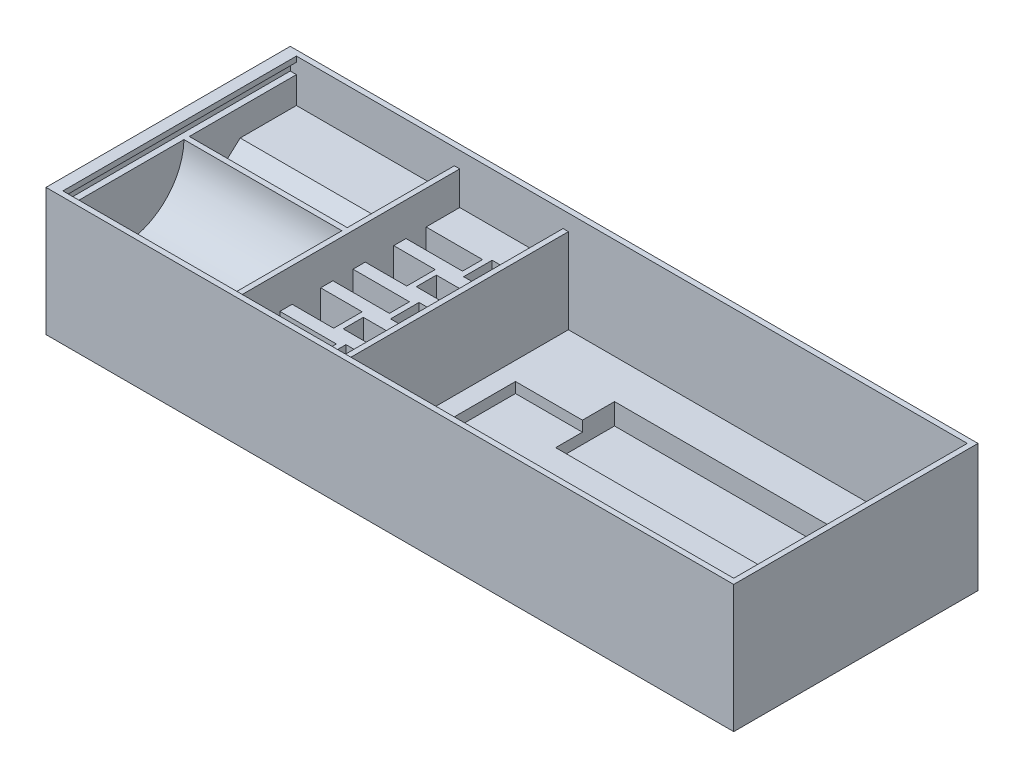
from build123d import *

# Parameters (mm, degrees)
BOSS_EXTRUDE1_DEPTH  = 2
BOSS_EXTRUDE2_DEPTH  = 87.25
BOSS_EXTRUDE4_DEPTH  = 2
BOSS_EXTRUDE5_DEPTH  = 59
SKETCH5_3_W          = 2
SKETCH5_3_H          = 10
BOSS_EXTRUDE6_DEPTH  = 59
BOSS_EXTRUDE7_DEPTH  = 59
BOSS_EXTRUDE8_DEPTH  = 6
SKETCH8_W            = 38.6
SKETCH8_H            = 87.25
CUT_EXTRUDE1_DEPTH   = 12.5
SKETCH9_W            = 15.5
SKETCH9_H            = 10.65
CUT_EXTRUDE2_DEPTH   = 13.6
SKETCH9_4_W          = 21.1
SKETCH9_4_H          = 7.5
CUT_EXTRUDE3_DEPTH   = 8.6
SKETCH10_W           = 135.3
SKETCH10_H           = 14.625
BOSS_EXTRUDE9_DEPTH  = 7.9
BOSS_EXTRUDE10_DEPTH = 4
SKETCH11_W           = 25
SKETCH11_H           = 7.9
BOSS_EXTRUDE14_DEPTH = 22
SKETCH12_W           = 25
SKETCH12_H           = 10
CUT_EXTRUDE4_DEPTH   = 3.9


with BuildPart() as part:
    # Sketch2 → Boss-Extrude1 (new body)
    with BuildSketch(Plane.XY):
        Polygon((-256.9, 0), (0, 0), (0, 41.64), (-254.9, 41.64), (-254.9, 45.64), (-252.6, 45.64), (-252.6, 47.64), (-256.9, 47.64), align=None)
    extrude(amount=-BOSS_EXTRUDE1_DEPTH)

    # Sketch2<3> → Boss-Extrude2 (add)
    with BuildSketch(Plane.XY):
        Polygon((-256.9, 0), (0, 0), (0, 41.64), (-2, 41.64), (-2, 9.9), (-8.85, 9.9), (-8.85, 2), (-144.15, 2), (-144.15, 9.9), (-151, 9.9), (-151, 41.64), (-153, 41.64), (-191.6, 41.64), (-193.6, 41.64), (-193.6, 2), (-252.6, 2), (-252.6, 41.64), (-254.9, 41.64), (-254.9, 45.64), (-252.6, 45.64), (-252.6, 47.64), (-256.9, 47.64), align=None)
    extrude(amount=BOSS_EXTRUDE2_DEPTH)

    # Sketch4 → Boss-Extrude4 (add)
    with BuildSketch(Plane.XY.offset(87.25)):
        Polygon((-256.9, 47.64), (-256.9, 0), (0, 0), (0, 41.64), (-254.9, 41.64), (-254.9, 45.64), (-252.6, 45.64), (-252.6, 47.64), align=None)
    extrude(amount=BOSS_EXTRUDE4_DEPTH)

    # Sketch5 → Boss-Extrude5 (add)
    with BuildSketch(Plane(origin=(-252.6, 0, 0), x_dir=(0, 0, -1), z_dir=(1, 0, 0))):
        Polygon((0, 2), (0, 31.64), (-21.014243309, 31.64), (-53.69, 2), align=None)
        Polygon((-72.69, 2), (-40.014243309, 31.64), (-42.014243309, 31.64), (-56.208170838, 18.764766047), (-87.25, 18.764766047), (-87.25, 2), align=None)
    extrude(amount=BOSS_EXTRUDE5_DEPTH)

    # Sketch5<3> → Boss-Extrude6 (add)
    with BuildSketch(Plane(origin=(-252.6, 0, 0), x_dir=(0, 0, -1), z_dir=(1, 0, 0))):
        with Locations((-41.014243309, 36.64)):
            Rectangle(SKETCH5_3_W, SKETCH5_3_H)
    extrude(amount=BOSS_EXTRUDE6_DEPTH)

    # Sketch6 → Boss-Extrude7 (add)
    with BuildSketch(Plane(origin=(-252.6, 0, 0), x_dir=(0, 0, -1), z_dir=(1, 0, 0))):
        with BuildLine():
            Line((-42.014243309, 31.64), (-42.014243309, 41.64))
            ThreePointArc((-42.014243309, 41.64), (-48.969941413, 25.441110515), (-65.285951379, 18.764766047))
            Line((-65.285951379, 18.764766047), (-56.208170838, 18.764766047))
            Line((-56.208170838, 18.764766047), (-42.014243309, 31.64))
        make_face()
    extrude(amount=BOSS_EXTRUDE7_DEPTH)

    # Sketch7 → Boss-Extrude8 (add)
    with BuildSketch(Plane(origin=(0, 41.64, 0), x_dir=(1, 0, 0), z_dir=(0, 1, 0))):
        Polygon((0, -89.25), (0, 2), (-254.9, 2), (-254.9, 0), (-252.6, 0), (-2, 0), (-2, -87.25), (-252.6, -87.25), (-254.9, -87.25), (-254.9, -89.25), align=None)
    extrude(amount=BOSS_EXTRUDE8_DEPTH)

    # Sketch8 → Cut-Extrude1 (cut)
    with BuildSketch(Plane(origin=(0, 41.64, 0), x_dir=(1, 0, 0), z_dir=(0, 1, 0))):
        with Locations((-172.3, -43.625)):
            Rectangle(SKETCH8_W, SKETCH8_H)
    extrude(amount=-CUT_EXTRUDE1_DEPTH, mode=Mode.SUBTRACT)

    # Sketch9 → Cut-Extrude2 (cut)
    with BuildSketch(Plane(origin=(0, 29.14, 0), x_dir=(1, 0, 0), z_dir=(0, 1, 0))):
        with Locations((-160.75, -16.325)):
            Rectangle(SKETCH9_W, SKETCH9_H)
        with Locations((-183.85, -29.975)):
            Rectangle(SKETCH9_W, SKETCH9_H)
        with Locations((-160.75, -43.625)):
            Rectangle(SKETCH9_W, SKETCH9_H)
        with Locations((-183.85, -57.275)):
            Rectangle(SKETCH9_W, SKETCH9_H)
        with Locations((-160.75, -70.925)):
            Rectangle(SKETCH9_W, SKETCH9_H)
    extrude(amount=-CUT_EXTRUDE2_DEPTH, mode=Mode.SUBTRACT)

    # Sketch9<4> → Cut-Extrude3 (cut)
    with BuildSketch(Plane(origin=(0, 29.14, 0), x_dir=(1, 0, 0), z_dir=(0, 1, 0))):
        with Locations((-181.05, -16.325)):
            Rectangle(SKETCH9_4_W, SKETCH9_4_H)
        with Locations((-181.05, -43.625)):
            Rectangle(SKETCH9_4_W, SKETCH9_4_H)
        with Locations((-163.55, -29.975)):
            Rectangle(SKETCH9_4_W, SKETCH9_4_H)
        with Locations((-181.05, -70.925)):
            Rectangle(SKETCH9_4_W, SKETCH9_4_H)
        with Locations((-163.55, -57.275)):
            Rectangle(SKETCH9_4_W, SKETCH9_4_H)
    extrude(amount=-CUT_EXTRUDE3_DEPTH, mode=Mode.SUBTRACT)

    # Sketch10 → Boss-Extrude9 (add)
    with BuildSketch(Plane(origin=(0, 2, 0), x_dir=(1, 0, 0), z_dir=(0, 1, 0))):
        with Locations((-76.5, -79.9375)):
            Rectangle(SKETCH10_W, SKETCH10_H)
        with Locations((-76.5, -7.3125)):
            Rectangle(SKETCH10_W, SKETCH10_H)
    extrude(amount=BOSS_EXTRUDE9_DEPTH)

    # Sketch10<4> → Boss-Extrude10 (add)
    with BuildSketch(Plane(origin=(0, 2, 0), x_dir=(1, 0, 0), z_dir=(0, 1, 0))):
        Polygon((-8.85, -36.625), (-144.15, -36.625), (-144.15, -72.625), (-76.5, -72.625), (-8.85, -72.625), align=None)
    extrude(amount=BOSS_EXTRUDE10_DEPTH)

    # Sketch11 → Boss-Extrude14 (add)
    with BuildSketch(Plane.XY.offset(14.625)):
        with Locations((-131.65, 5.95)):
            Rectangle(SKETCH11_W, SKETCH11_H)
        with Locations((-21.35, 5.95)):
            Rectangle(SKETCH11_W, SKETCH11_H)
    extrude(amount=BOSS_EXTRUDE14_DEPTH)

    # Sketch12 → Cut-Extrude4 (cut)
    with BuildSketch(Plane(origin=(0, 9.9, 0), x_dir=(1, 0, 0), z_dir=(0, 1, 0))):
        with Locations((-131.65, -31.625)):
            Rectangle(SKETCH12_W, SKETCH12_H)
        with Locations((-21.35, -31.625)):
            Rectangle(SKETCH12_W, SKETCH12_H)
    extrude(amount=-CUT_EXTRUDE4_DEPTH, mode=Mode.SUBTRACT)


solid = part.part
